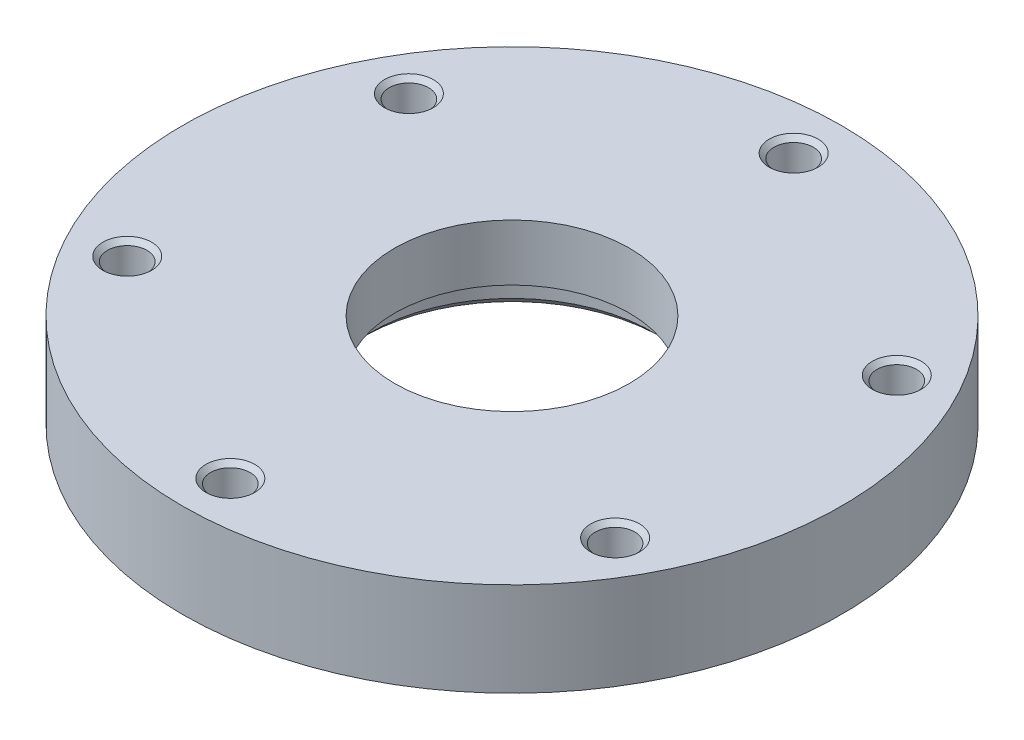
from build123d import *

# Parameters (mm, degrees)
SKETCH1_R           = 35.1
SKETCH1_R_2         = 2.1
SKETCH1_R_3         = 15
MAIN_BODY_DEPTH     = 10
CHAMFER3_SIZE       = 0.5
CHAMFER4_SIZE       = 1
BOSS_EXTRUDE4_START = -6
SKETCH2_R           = 15
SKETCH2_R_2         = 12.5
BOSS_EXTRUDE4_DEPTH = 6
CUT_EXTRUDE1_DEPTH  = 2.5


with BuildPart() as part:
    # Sketch1 → Main Body (new body)
    with BuildSketch(Plane(origin=(0, 0, 0), x_dir=(1, 0, 0), z_dir=(0, 1, 0))):
        with Locations(Location((0, 0, 0), (0, 0, 270))):
            Circle(SKETCH1_R)
        with Locations(Location((0, 30, 0), (0, 0, 270))):
            Circle(SKETCH1_R_2, mode=Mode.SUBTRACT)
        with Locations(Location((25.980762114, 15, 0), (0, 0, 270))):
            Circle(SKETCH1_R_2, mode=Mode.SUBTRACT)
        with Locations(Location((25.980762114, -15, 0), (0, 0, 270))):
            Circle(SKETCH1_R_2, mode=Mode.SUBTRACT)
        with Locations(Location((0, -30, 0), (0, 0, 270))):
            Circle(SKETCH1_R_2, mode=Mode.SUBTRACT)
        with Locations(Location((-25.980762114, -15, 0), (0, 0, 270))):
            Circle(SKETCH1_R_2, mode=Mode.SUBTRACT)
        with Locations(Location((-25.980762114, 15, 0), (0, 0, 270))):
            Circle(SKETCH1_R_2, mode=Mode.SUBTRACT)
        with Locations(Location((0, 0, 0), (0, 0, 270))):
            Circle(SKETCH1_R_3, mode=Mode.SUBTRACT)
    extrude(amount=MAIN_BODY_DEPTH)

    # Chamfer3
    chamfer3_edges = [part.edges().sort_by_distance(p)[0] for p in [
        (25.980762114, 10, -17.1),
        (25.980762114, 10, 12.9),
        (0, 10, 27.9),
        (-25.980762114, 10, 12.9),
        (-25.980762114, 10, -17.1),
        (0, 10, -32.1),
    ]]
    chamfer(chamfer3_edges, length=CHAMFER3_SIZE)

    # Chamfer4
    chamfer4_edges = [part.edges().sort_by_distance(p)[0] for p in [
        (0, 0, -15),
    ]]
    chamfer(chamfer4_edges, length=CHAMFER4_SIZE)

    # Sketch2 → Boss-Extrude4 (add)
    with BuildSketch(Plane(origin=(0, 10, 0), x_dir=(1, 0, 0), z_dir=(0, 1, 0)).offset(BOSS_EXTRUDE4_START)):
        with Locations(Location((0, 0, 0), (0, 0, 270))):
            Circle(SKETCH2_R)
        with Locations(Location((0, 0, 0), (0, 0, 270))):
            Circle(SKETCH2_R_2, mode=Mode.SUBTRACT)
    extrude(amount=BOSS_EXTRUDE4_DEPTH)

    # Sketch3 → Cut-Extrude1 (cut)
    with BuildSketch(Plane.XZ):
        Polygon((25.980762114, 10.958548116), (29.480762114, 12.979274058), (29.480762114, 17.020725942), (25.980762114, 19.041451884), (22.480762114, 17.020725942), (22.480762114, 12.979274058), align=None)
        Polygon((0, 25.958548116), (3.5, 27.979274058), (3.5, 32.020725942), (0, 34.041451884), (-3.5, 32.020725942), (-3.5, 27.979274058), align=None)
        Polygon((22.480762114, -17.020725942), (25.980762114, -19.041451884), (29.480762114, -17.020725942), (29.480762114, -12.979274058), (25.980762114, -10.958548116), (22.480762114, -12.979274058), align=None)
        Polygon((-3.5, -27.979274058), (-3.5, -32.020725942), (0, -34.041451884), (3.5, -32.020725942), (3.5, -27.979274058), (0, -25.958548116), align=None)
        Polygon((-25.980762114, -10.958548116), (-29.480762114, -12.979274058), (-29.480762114, -17.020725942), (-25.980762114, -19.041451884), (-22.480762114, -17.020725942), (-22.480762114, -12.979274058), align=None)
        Polygon((-22.480762114, 17.020725942), (-25.980762114, 19.041451884), (-29.480762114, 17.020725942), (-29.480762114, 12.979274058), (-25.980762114, 10.958548116), (-22.480762114, 12.979274058), align=None)
    extrude(amount=-CUT_EXTRUDE1_DEPTH, mode=Mode.SUBTRACT)


solid = part.part
